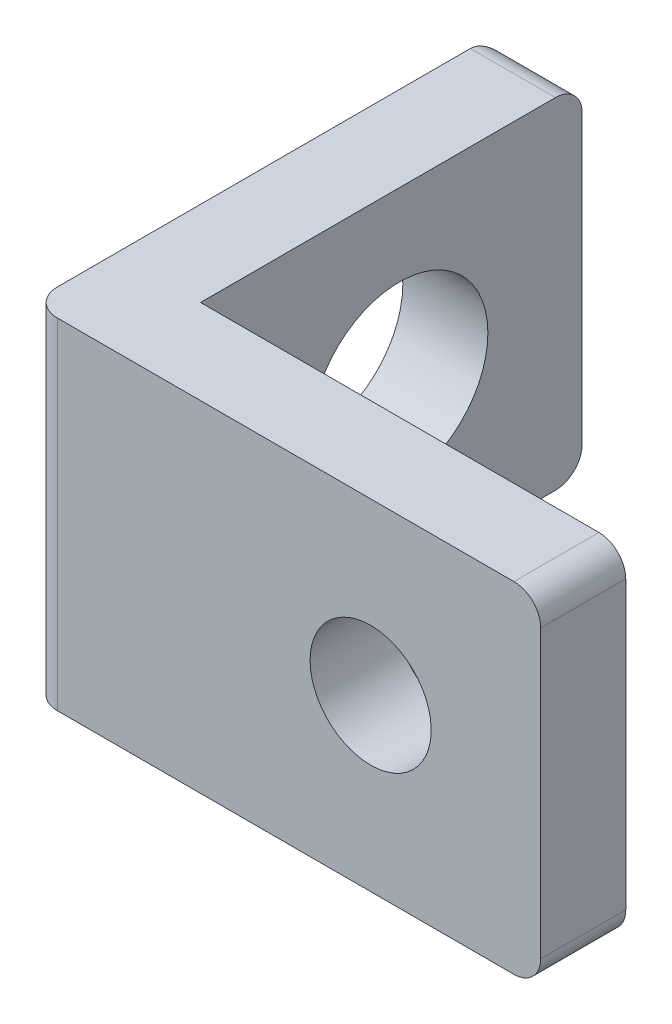
from build123d import *

# Parameters (mm, degrees)
BOSS_EXTRUDE1_DEPTH   = 6.35
CUT_EXTRUDE1_REACH    = 15.388
SKETCH2_R             = 1.651
F_4_40_TAPPED_HOLE2_D = 2.2606
FILLET1_R             = 0.5


with BuildPart() as part:
    # Sketch1 → Boss-Extrude1 (new body)
    with BuildSketch(Plane(origin=(0, 0, 0), x_dir=(1, 0, 0), z_dir=(0, 1, 0))):
        Polygon((0, 8.7122), (0, 0), (9.525, 0), (9.525, 1.5875), (1.5875, 1.5875), (1.5875, 8.7122), align=None)
    extrude(amount=BOSS_EXTRUDE1_DEPTH)

    # Sketch2 → Cut-Extrude1 (cut, up to next)
    with BuildSketch(Plane(origin=(1.5875, 0, 0), x_dir=(0, 0, -1), z_dir=(1, 0, 0)), mode=Mode.PRIVATE) as cut_extrude1_sk1:
        with Locations((5.3, 3.175)):
            Circle(SKETCH2_R)
    cut_extrude1_tool1 = extrude(cut_extrude1_sk1.sketch, amount=-CUT_EXTRUDE1_REACH, mode=Mode.PRIVATE) & part.part
    add(cut_extrude1_tool1.solids().sort_by_distance((1.5875, 3.175, -5.3))[0], mode=Mode.SUBTRACT)

    # #4-40 Tapped Hole2 (through all)
    with Locations(Plane(origin=(6.35, 3.175, -1.5875), x_dir=(-1, 0, 0), z_dir=(0, 0, -1))):
        with Locations((0, 0)):
            Hole(F_4_40_TAPPED_HOLE2_D / 2)

    # Fillet1
    fillet1_edges = [part.edges().sort_by_distance(p)[0] for p in [
        (0, 3.175, 0),
        (0, 3.175, -8.7122),
        (9.525, 6.35, -0.79375),
        (9.525, 0, -0.79375),
        (0.79375, 6.35, -8.7122),
        (0.79375, 0, -8.7122),
    ]]
    fillet(fillet1_edges, radius=FILLET1_R)


solid = part.part
